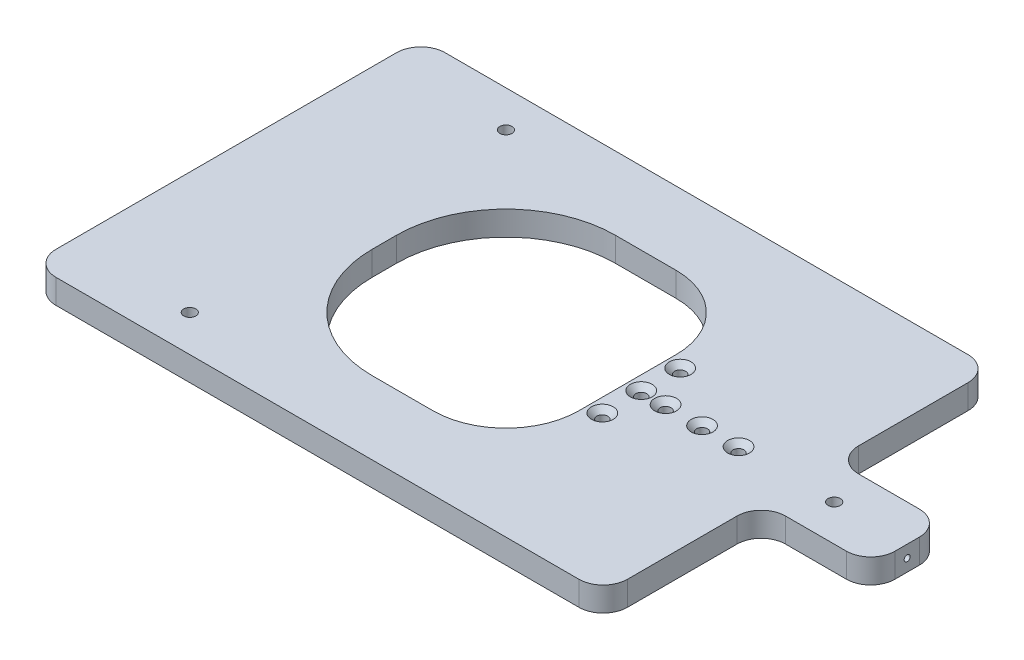
from build123d import *

# Parameters (mm, degrees)
SKETCH1_R                                            = 1.5
SKETCH1_W                                            = 100
SKETCH1_H                                            = 100
BOSS_EXTRUDE1_DEPTH                                  = 10
FILLET1_R                                            = 10
CSK_FOR_M4_HEX_SOCKET_COUNTERSUNK_CAP_SC_D           = 4.5
CSK_FOR_M4_HEX_SOCKET_COUNTERSUNK_CAP_SC_CSINK_D     = 8.96
CSK_FOR_M4_HEX_SOCKET_COUNTERSUNK_CAP_SC_CSINK_ANGLE = 90
SKETCH14_R                                           = 2.5
CUT_EXTRUDE1_DEPTH                                   = 8
FILLET2_R                                            = 45
M6_TAPPED_HOLE1_D                                    = 5
M3_TAPPED_HOLE2_D                                    = 2.5
M3_TAPPED_HOLE2_DEPTH                                = 21.5
M3_TAPPED_HOLE2_TIP                                  = 0.751075774
M3_TAPPED_HOLE1_D                                    = 2.5
M3_TAPPED_HOLE1_DEPTH                                = 21.5
M3_TAPPED_HOLE1_TIP                                  = 0.751075774
FILLET3_R                                            = 30


with BuildPart() as part:
    # Sketch1 → Boss-Extrude1 (new body)
    with BuildSketch(Plane(origin=(0, 0, 0), x_dir=(1, 0, 0), z_dir=(0, 1, 0))):
        Polygon((0, 0), (0, 160), (235, 160), (235, 95), (280, 95), (280, 65), (235, 65), (235, 0), align=None)
        with Locations(Location((50, 145, 0), (0, 0, 270))):
            Circle(SKETCH1_R, mode=Mode.SUBTRACT)
        with Locations(Location((50, 15, 0), (0, 0, 270))):
            Circle(SKETCH1_R, mode=Mode.SUBTRACT)
        with Locations(Location((250, 80, 0), (0, 0, 270))):
            Circle(SKETCH1_R, mode=Mode.SUBTRACT)
        with Locations((115, 80)):
            Rectangle(SKETCH1_W, SKETCH1_H, mode=Mode.SUBTRACT)
    extrude(amount=BOSS_EXTRUDE1_DEPTH)

    # Fillet1
    fillet1_edges = [part.edges().sort_by_distance(p)[0] for p in [
        (0, 5, 0),
        (0, 5, -160),
        (235, 5, -160),
        (235, 5, -95),
        (280, 5, -95),
        (280, 5, -65),
        (235, 5, -65),
        (235, 5, 0),
    ]]
    fillet(fillet1_edges, radius=FILLET1_R)

    # CSK for M4 Hex Socket Countersunk Cap Screw1 (through all)
    with Locations(Plane(origin=(0, 10, 0), x_dir=(1, 0, 0), z_dir=(0, 1, 0))):
        with Locations((170.65, 80), (180.65, 80), (195.65, 80), (210.65, 80), (170.65, 96), (170.65, 64)):
            CounterSinkHole(CSK_FOR_M4_HEX_SOCKET_COUNTERSUNK_CAP_SC_D / 2, CSK_FOR_M4_HEX_SOCKET_COUNTERSUNK_CAP_SC_CSINK_D / 2, counter_sink_angle=CSK_FOR_M4_HEX_SOCKET_COUNTERSUNK_CAP_SC_CSINK_ANGLE)

    # Sketch14 → Cut-Extrude1 (cut)
    with BuildSketch(Plane.XZ):
        with Locations(Location((270, -80, 0), (0, 0, 270))):
            Circle(SKETCH14_R)
        with Locations(Location((15, -15, 0), (0, 0, 270))):
            Circle(SKETCH14_R)
        with Locations(Location((15, -140, 0), (0, 0, 270))):
            Circle(SKETCH14_R)
    extrude(amount=-CUT_EXTRUDE1_DEPTH, mode=Mode.SUBTRACT)

    # Fillet2
    fillet2_edges = [part.edges().sort_by_distance(p)[0] for p in [
        (65, 5, -130),
        (65, 5, -30),
    ]]
    fillet(fillet2_edges, radius=FILLET2_R)

    # M6 Tapped Hole1 (through all)
    with Locations(Plane(origin=(0, 10, 0), x_dir=(1, 0, 0), z_dir=(0, 1, 0))):
        with Locations((50, 145), (250, 80), (50, 15)):
            Hole(M6_TAPPED_HOLE1_D / 2)

    # M3 Tapped Hole2
    with Locations(Plane(origin=(280, 5, -80), x_dir=(0, 0, 1), z_dir=(1, 0, 0))):
        with Locations((0, 0)):
            Hole(M3_TAPPED_HOLE2_D / 2, depth=M3_TAPPED_HOLE2_DEPTH)
            with Locations((0, 0, -(M3_TAPPED_HOLE2_DEPTH + M3_TAPPED_HOLE2_TIP / 2))):  # 118° drill point
                Cone(0, M3_TAPPED_HOLE2_D / 2, M3_TAPPED_HOLE2_TIP, mode=Mode.SUBTRACT)

    # M3 Tapped Hole1
    with Locations(Plane.ZY):
        with Locations((-140, 5), (-15, 5)):
            Hole(M3_TAPPED_HOLE1_D / 2, depth=M3_TAPPED_HOLE1_DEPTH)
            with Locations((0, 0, -(M3_TAPPED_HOLE1_DEPTH + M3_TAPPED_HOLE1_TIP / 2))):  # 118° drill point
                Cone(0, M3_TAPPED_HOLE1_D / 2, M3_TAPPED_HOLE1_TIP, mode=Mode.SUBTRACT)

    # Fillet3
    fillet3_edges = [part.edges().sort_by_distance(p)[0] for p in [
        (165, 5, -30),
        (165, 5, -130),
    ]]
    fillet(fillet3_edges, radius=FILLET3_R)


solid = part.part
